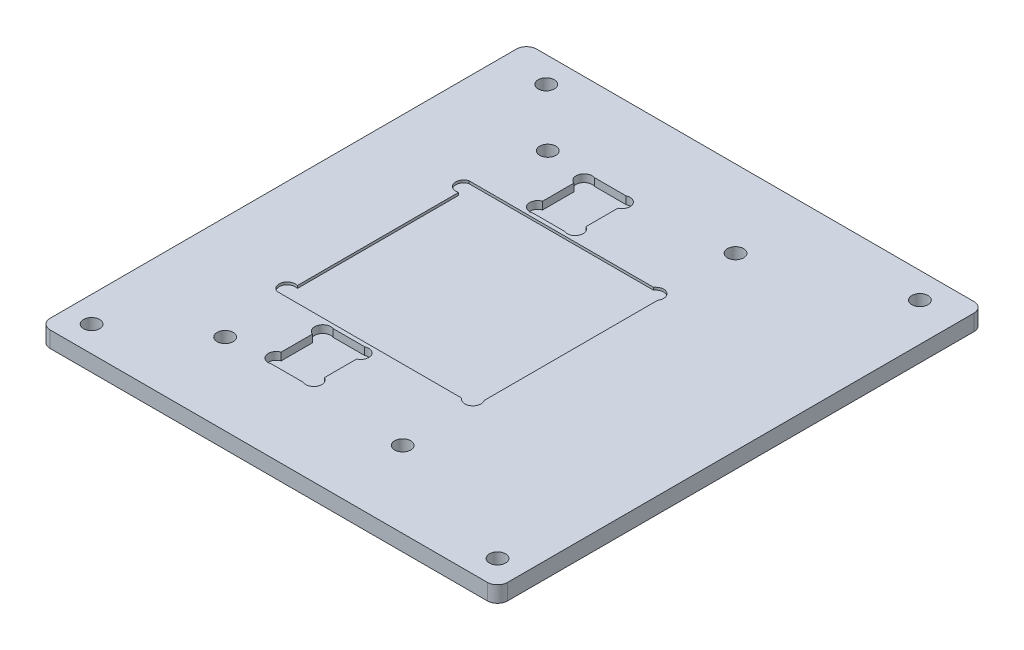
from build123d import *

# Parameters (mm, degrees)
BOSS_EXTRUDE1_DEPTH = 3.175
SKETCH2_R           = 1.5875
SKETCH2_R_2         = 1.59
CUT_EXTRUDE1_DEPTH  = 132.664731895
CUT_EXTRUDE2_DEPTH  = 0.5
CUT_EXTRUDE3_DEPTH  = 1.5


with BuildPart() as part:
    # Sketch1 → Boss-Extrude1 (new body)
    with BuildSketch(Plane(origin=(0, 0, 0), x_dir=(1, 0, 0), z_dir=(0, 1, 0))):
        with BuildLine():
            Line((2, 0), (88.17, 0))
            ThreePointArc((88.17, 0), (89.584213562, 0.585786438), (90.17, 2))
            Line((90.17, 2), (90.17, 93.89))
            ThreePointArc((90.17, 93.89), (89.584213562, 95.304213562), (88.17, 95.89))
            Line((88.17, 95.89), (2, 95.89))
            ThreePointArc((2, 95.89), (0.585786438, 95.304213562), (0, 93.89))
            Line((0, 93.89), (0, 2))
            ThreePointArc((0, 2), (0.585786438, 0.585786438), (2, 0))
        make_face()
    extrude(amount=BOSS_EXTRUDE1_DEPTH)

    # Sketch2 → Cut-Extrude1 (cut, through all)
    with BuildSketch(Plane(origin=(0, 3.175, 0), x_dir=(1, 0, 0), z_dir=(0, 1, 0))):
        with Locations(Location((5.08, 5.08, 0), (0, 0, 270))):
            Circle(SKETCH2_R)
        with Locations(Location((8.96488723, 90.81, 0), (0, 0, 270))):
            Circle(SKETCH2_R)
        with Locations(Location((85.09, 5.08, 0), (0, 0, 270))):
            Circle(SKETCH2_R)
        with Locations(Location((82.62488723, 90.81, 0), (0, 0, 270))):
            Circle(SKETCH2_R)
        with Locations(Location((20.45, 16.036, 0), (0, 0, 270))):
            Circle(SKETCH2_R_2)
        with Locations(Location((20.45, 79.636, 0), (0, 0, 270))):
            Circle(SKETCH2_R)
        with Locations(Location((56.45, 80.636, 0), (0, 0, 270))):
            Circle(SKETCH2_R)
        with Locations(Location((56.45, 15.036, 0), (0, 0, 270))):
            Circle(SKETCH2_R)
    extrude(amount=-CUT_EXTRUDE1_DEPTH, mode=Mode.SUBTRACT)

    # Sketch3 → Cut-Extrude2 (cut)
    with BuildSketch(Plane(origin=(0, 3.175, 0), x_dir=(1, 0, 0), z_dir=(0, 1, 0))):
        with BuildLine():
            Line((17.786991297, 66.746), (54.196641075, 66.746))
            ThreePointArc((54.196641075, 66.746), (56.404844266, 67.151155734), (56.81, 64.942952544))
            Line((56.81, 64.942952544), (56.81, 30.729047456))
            ThreePointArc((56.81, 30.729047456), (56.404844266, 28.520844266), (54.196641075, 28.926))
            Line((54.196641075, 28.926), (17.786991297, 28.926))
            ThreePointArc((17.786991297, 28.926), (16.775636345, 30.930363655), (18.78, 31.941718607))
            Line((18.78, 31.941718607), (18.78, 63.730281393))
            ThreePointArc((18.78, 63.730281393), (16.775636345, 64.741636345), (17.786991297, 66.746))
        make_face()
    extrude(amount=-CUT_EXTRUDE2_DEPTH, mode=Mode.SUBTRACT)

    # Sketch4 → Cut-Extrude3 (cut)
    with BuildSketch(Plane(origin=(0, 3.175, 0), x_dir=(1, 0, 0), z_dir=(0, 1, 0))):
        with BuildLine():
            Line((29.63877923, 28.126), (35.86122077, 28.126))
            ThreePointArc((35.86122077, 28.126), (37.961961131, 27.334038869), (37.17, 25.233298507))
            Line((37.17, 25.233298507), (37.17, 18.898701493))
            ThreePointArc((37.17, 18.898701493), (37.961961131, 16.797961131), (35.86122077, 16.006))
            Line((35.86122077, 16.006), (29.63877923, 16.006))
            ThreePointArc((29.63877923, 16.006), (27.603149796, 16.952850204), (28.55, 18.988479638))
            Line((28.55, 18.988479638), (28.55, 25.143520362))
            ThreePointArc((28.55, 25.143520362), (27.603149796, 27.179149796), (29.63877923, 28.126))
        make_face()
        with BuildLine():
            Line((37.17, 76.753298507), (37.17, 70.418701493))
            ThreePointArc((37.17, 70.418701493), (37.961961131, 68.317961131), (35.86122077, 67.526))
            Line((35.86122077, 67.526), (29.63877923, 67.526))
            ThreePointArc((29.63877923, 67.526), (27.603149796, 68.472850204), (28.55, 70.508479638))
            Line((28.55, 70.508479638), (28.55, 76.663520362))
            ThreePointArc((28.55, 76.663520362), (27.603149796, 78.699149796), (29.63877923, 79.646))
            Line((29.63877923, 79.646), (35.86122077, 79.646))
            ThreePointArc((35.86122077, 79.646), (37.961961131, 78.854038869), (37.17, 76.753298507))
        make_face()
    extrude(amount=-CUT_EXTRUDE3_DEPTH, mode=Mode.SUBTRACT)


solid = part.part
